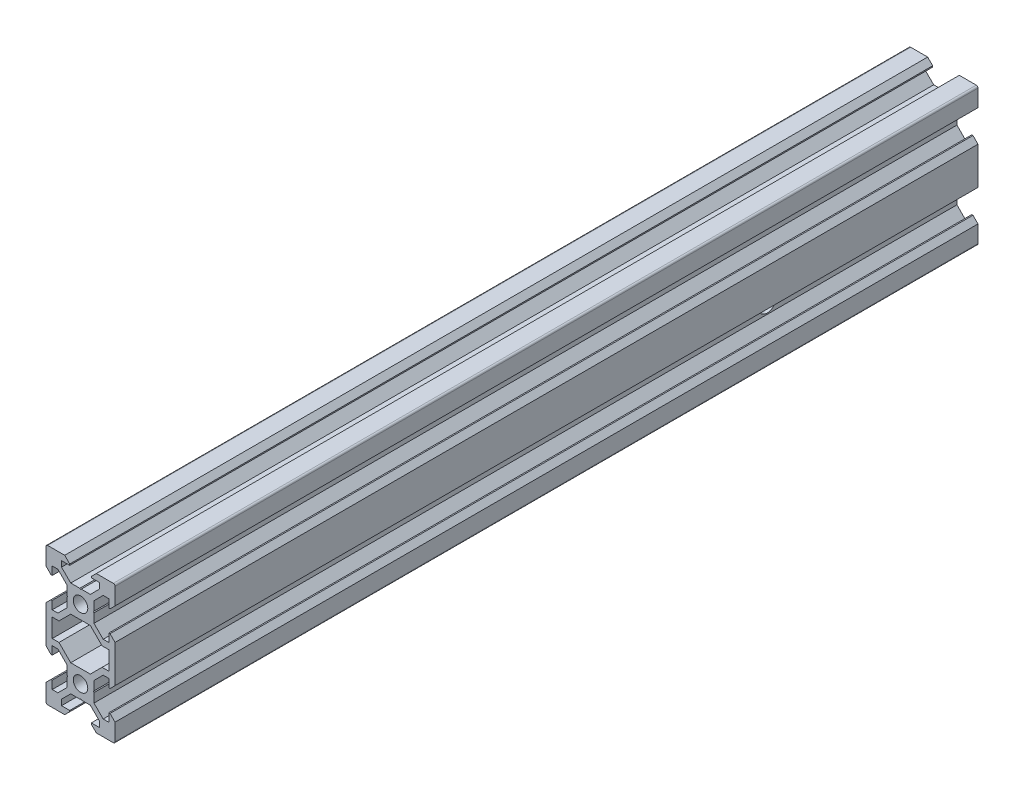
from build123d import *

# Parameters (mm, degrees)
ESBO_O1_R                = 2.1
RESSALTO_EXTRUS_O1_DEPTH = 250
CORTE_EXTRUS_O1_REACH    = 253.595
ESBO_O2_R                = 2.5


with BuildPart() as part:
    # Esboço1 → Ressalto-extrusão1 (new body)
    with BuildSketch(Plane.XY):
        with BuildLine():
            Line((3.9, 9.79), (3.69, 10))
            Line((3.69, 10), (3.9, 10.21))
            Line((3.9, 10.21), (3.9, 12.839339828))
            Line((3.9, 12.839339828), (6.560660172, 15.5))
            Line((6.560660172, 15.5), (8.2, 15.5))
            Line((8.2, 15.5), (8.2, 13.125))
            Line((8.2, 13.125), (8.545, 13.125))
            Line((8.545, 13.125), (10, 14.58))
            Line((10, 14.58), (10, 19.5))
            ThreePointArc((10, 19.5), (9.853553391, 19.853553391), (9.5, 20))
            Line((9.5, 20), (4.58, 20))
            Line((4.58, 20), (3.125, 18.545))
            Line((3.125, 18.545), (3.125, 18.2))
            Line((3.125, 18.2), (5.5, 18.2))
            Line((5.5, 18.2), (5.5, 16.560660172))
            Line((5.5, 16.560660172), (2.839339828, 13.9))
            Line((2.839339828, 13.9), (0.21, 13.9))
            Line((0.21, 13.9), (0, 13.69))
            Line((0, 13.69), (-0.21, 13.9))
            Line((-0.21, 13.9), (-2.839339828, 13.9))
            Line((-2.839339828, 13.9), (-5.5, 16.560660172))
            Line((-5.5, 16.560660172), (-5.5, 18.2))
            Line((-5.5, 18.2), (-3.125, 18.2))
            Line((-3.125, 18.2), (-3.125, 18.545))
            Line((-3.125, 18.545), (-4.58, 20))
            Line((-4.58, 20), (-9.5, 20))
            ThreePointArc((-9.5, 20), (-9.853553391, 19.853553391), (-10, 19.5))
            Line((-10, 19.5), (-10, 14.58))
            Line((-10, 14.58), (-8.545, 13.125))
            Line((-8.545, 13.125), (-8.2, 13.125))
            Line((-8.2, 13.125), (-8.2, 15.5))
            Line((-8.2, 15.5), (-6.560660172, 15.5))
            Line((-6.560660172, 15.5), (-3.9, 12.839339828))
            Line((-3.9, 12.839339828), (-3.9, 10.21))
            Line((-3.9, 10.21), (-3.69, 10))
            Line((-3.69, 10), (-3.9, 9.79))
            Line((-3.9, 9.79), (-3.9, 7.160660172))
            Line((-3.9, 7.160660172), (-6.560660172, 4.5))
            Line((-6.560660172, 4.5), (-8.2, 4.5))
            Line((-8.2, 4.5), (-8.2, 6.875))
            Line((-8.2, 6.875), (-8.545, 6.875))
            Line((-8.545, 6.875), (-10, 5.42))
            Line((-10, 5.42), (-10, -5.42))
            Line((-10, -5.42), (-8.545, -6.875))
            Line((-8.545, -6.875), (-8.2, -6.875))
            Line((-8.2, -6.875), (-8.2, -4.5))
            Line((-8.2, -4.5), (-6.560660172, -4.5))
            Line((-6.560660172, -4.5), (-3.9, -7.160660172))
            Line((-3.9, -7.160660172), (-3.9, -9.79))
            Line((-3.9, -9.79), (-3.69, -10))
            Line((-3.69, -10), (-3.9, -10.21))
            Line((-3.9, -10.21), (-3.9, -12.839339828))
            Line((-3.9, -12.839339828), (-6.560660172, -15.5))
            Line((-6.560660172, -15.5), (-8.2, -15.5))
            Line((-8.2, -15.5), (-8.2, -13.125))
            Line((-8.2, -13.125), (-8.545, -13.125))
            Line((-8.545, -13.125), (-10, -14.58))
            Line((-10, -14.58), (-10, -19.5))
            ThreePointArc((-10, -19.5), (-9.853553391, -19.853553391), (-9.5, -20))
            Line((-9.5, -20), (-4.58, -20))
            Line((-4.58, -20), (-3.125, -18.545))
            Line((-3.125, -18.545), (-3.125, -18.2))
            Line((-3.125, -18.2), (-5.5, -18.2))
            Line((-5.5, -18.2), (-5.5, -16.560660172))
            Line((-5.5, -16.560660172), (-2.839339828, -13.9))
            Line((-2.839339828, -13.9), (-0.21, -13.9))
            Line((-0.21, -13.9), (0, -13.69))
            Line((0, -13.69), (0.21, -13.9))
            Line((0.21, -13.9), (2.839339828, -13.9))
            Line((2.839339828, -13.9), (5.5, -16.560660172))
            Line((5.5, -16.560660172), (5.5, -18.2))
            Line((5.5, -18.2), (3.125, -18.2))
            Line((3.125, -18.2), (3.125, -18.545))
            Line((3.125, -18.545), (4.58, -20))
            Line((4.58, -20), (9.5, -20))
            ThreePointArc((9.5, -20), (9.853553391, -19.853553391), (10, -19.5))
            Line((10, -19.5), (10, -14.58))
            Line((10, -14.58), (8.545, -13.125))
            Line((8.545, -13.125), (8.2, -13.125))
            Line((8.2, -13.125), (8.2, -15.5))
            Line((8.2, -15.5), (6.560660172, -15.5))
            Line((6.560660172, -15.5), (3.9, -12.839339828))
            Line((3.9, -12.839339828), (3.9, -10.21))
            Line((3.9, -10.21), (3.69, -10))
            Line((3.69, -10), (3.9, -9.79))
            Line((3.9, -9.79), (3.9, -7.160660172))
            Line((3.9, -7.160660172), (6.560660172, -4.5))
            Line((6.560660172, -4.5), (8.2, -4.5))
            Line((8.2, -4.5), (8.2, -6.875))
            Line((8.2, -6.875), (8.545, -6.875))
            Line((8.545, -6.875), (10, -5.42))
            Line((10, -5.42), (10, 5.42))
            Line((10, 5.42), (8.545, 6.875))
            Line((8.545, 6.875), (8.2, 6.875))
            Line((8.2, 6.875), (8.2, 4.5))
            Line((8.2, 4.5), (6.560660172, 4.5))
            Line((6.560660172, 4.5), (3.9, 7.160660172))
            Line((3.9, 7.160660172), (3.9, 9.79))
        make_face()
        with Locations((0, -10)):
            Circle(ESBO_O1_R, mode=Mode.SUBTRACT)
        with Locations((0, 10)):
            Circle(ESBO_O1_R, mode=Mode.SUBTRACT)
        Polygon((8.2, -2.7), (8.2, 2.7), (6.239339828, 2.7), (2.839339828, 6.1), (-2.839339828, 6.1), (-6.239339828, 2.7), (-8.2, 2.7), (-8.2, -2.7), (-6.239339828, -2.7), (-2.839339828, -6.1), (2.839339828, -6.1), (6.239339828, -2.7), align=None, mode=Mode.SUBTRACT)
    extrude(amount=RESSALTO_EXTRUS_O1_DEPTH)

    # Corte-extrusão1: up to this face of the body (flat: up to its plane)
    corte_extrus_o1_end = Plane(part.part.faces().sort_by_distance((-10, 0, 125))[0])
    # Esboço2 → Corte-extrusão1 (cut, up to the picked face)
    with BuildSketch(Plane(origin=(10, 0, 0), x_dir=(0, 0, -1), z_dir=(1, 0, 0)), mode=Mode.PRIVATE) as corte_extrus_o1_sk1:
        with Locations((-55, -10)):
            Circle(ESBO_O2_R)
    corte_extrus_o1_tool1 = split(extrude(corte_extrus_o1_sk1.sketch, amount=-CORTE_EXTRUS_O1_REACH, mode=Mode.PRIVATE), bisect_by=corte_extrus_o1_end, keep=Keep.BOTH, mode=Mode.PRIVATE)
    add(corte_extrus_o1_tool1.solids().sort_by(Axis((10, -10, 55), (-1, 0, 0)))[0], mode=Mode.SUBTRACT)


solid = part.part
